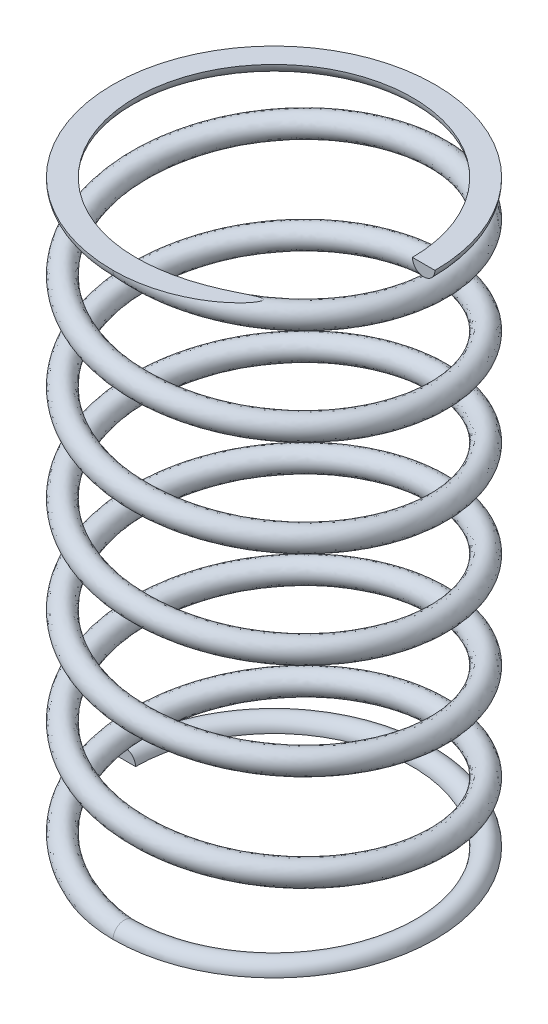
from build123d import *

# Parameters (mm, degrees)
SWEEP1_PROFILE_R        = 0.889
SWEEP2_PROFILE_R        = 0.889
SWEEP3_PITCH            = 7.62
SWEEP3_HEIGHT           = 45.72
SWEEP3_RADIUS           = 11.811
SWEEP3_PROFILE_R        = 0.889
CUT_EXTRUDE1_DEPTH      = 50.949764765
CUT_EXTRUDE1_DEPTH_BACK = 50.949764765
SKETCH4_W               = 25.4
SKETCH4_H               = 3.81


with BuildPart() as part:
    # Sweep1: sweep along a path in Sketch3
    with BuildLine(Plane(origin=(0, 45.72, 0), x_dir=(1, 0, 0), z_dir=(0, 1, 0))) as sweep1_path:
        ThreePointArc((0, -11.811), (-8.351638193, 8.351638193), (11.811, 0))
    # Sweep1 profile (on start of the path) → Sweep1 (sweep)
    with BuildSketch(Plane(origin=(0, 45.72, 11.811), x_dir=(0, 0, -1), z_dir=(-1, 0, 0))):
        Circle(SWEEP1_PROFILE_R)
    sweep(path=sweep1_path.line)



with BuildPart() as body_2:
    # Sweep2: sweep along a path in Sketch2
    with BuildLine(Plane(origin=(0, 0, 0), x_dir=(1, 0, 0), z_dir=(0, 1, 0))) as sweep2_path:
        ThreePointArc((-11.811, 0), (8.351638193, 8.351638193), (0, -11.811))
    # Sweep2 profile (on start of the path) → Sweep2 (sweep)
    with BuildSketch(Plane(origin=(-11.811, 0, 0), x_dir=(-1, 0, 0), z_dir=(0, 0, -1))):
        Circle(SWEEP2_PROFILE_R)
    sweep(path=sweep2_path.line)


with BuildPart() as part_1:
    add(part.part)

    add(body_2.part)  # Sweep3 merges body 2
    # Sweep3: sweep along a helix
    with BuildLine() as sweep3_path:
        Helix(SWEEP3_PITCH, SWEEP3_HEIGHT, SWEEP3_RADIUS, center=(0, 0, 0), direction=(0, 1, 0), lefthand=True)
    # Sweep3 profile (on start of the path) → Sweep3 (sweep)
    with BuildSketch(Plane(origin=(0, 0, 11.811), x_dir=(-0.10214355486825902, -0.9947696689178229, 0), z_dir=(-0.9947696689178229, 0.10214355486825902, 8.050999414777835e-13))):
        Circle(SWEEP3_PROFILE_R)
    sweep(path=sweep3_path.line, is_frenet=True)

    # Sketch4 → Cut-Extrude1 (cut, two sides: drawn at the far end of the back side and taken through both)
    with BuildSketch(Plane.XY.offset(-CUT_EXTRUDE1_DEPTH_BACK)):
        with Locations((0, -1.905)):
            Rectangle(SKETCH4_W, SKETCH4_H)
        with Locations((0, 47.625)):
            Rectangle(SKETCH4_W, SKETCH4_H)
    extrude(amount=CUT_EXTRUDE1_DEPTH + CUT_EXTRUDE1_DEPTH_BACK, mode=Mode.SUBTRACT)


solid = part_1.part
